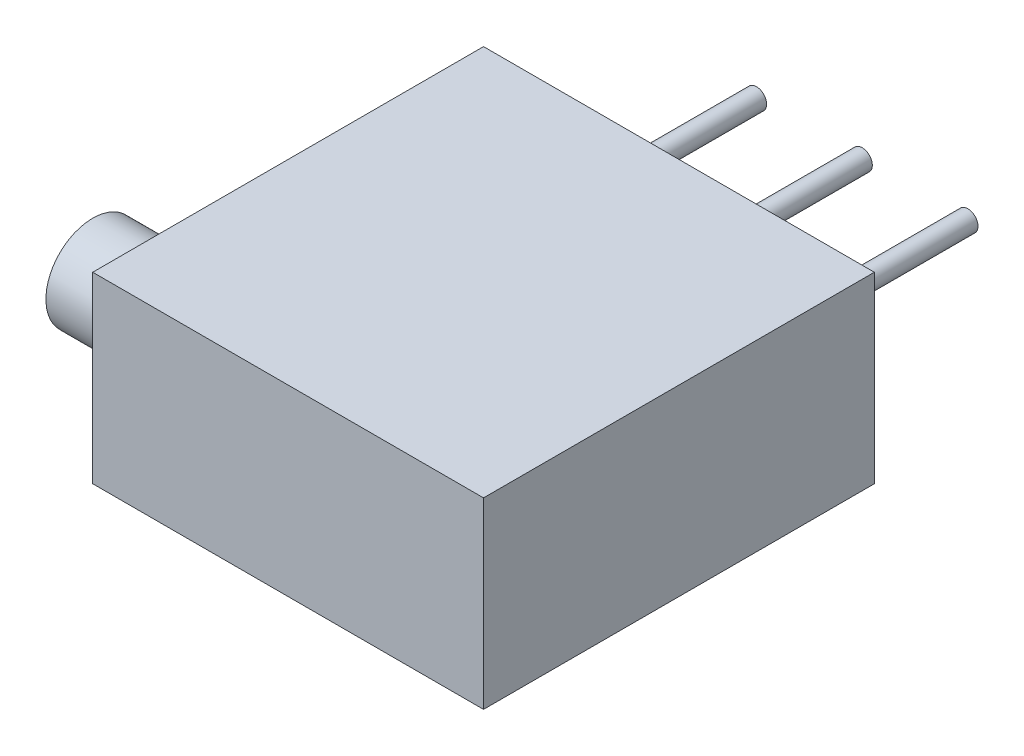
from build123d import *

# Parameters (mm, degrees)
SKETCH_1_W      = 9.6
SKETCH_1_H      = 9.6
EXTRUDE_1_DEPTH = 4.5
SKETCH_3_R      = 0.25
EXTRUDE_3_DEPTH = 4.5
SKETCH_4_R      = 1.15
EXTRUDE_4_DEPTH = 1.5


with BuildPart() as part:
    # 草图1 → 拉伸1 (new body)
    with BuildSketch(Plane(origin=(0, 0, 0), x_dir=(1, 0, 0), z_dir=(0, 1, 0))):
        Rectangle(SKETCH_1_W, SKETCH_1_H)
    extrude(amount=EXTRUDE_1_DEPTH)

    # 草图3 → 拉伸3 (add)
    with BuildSketch(Plane(origin=(0, 0, -4.8), x_dir=(-1, 0, 0), z_dir=(0, 0, -1))):
        with Locations(Location((0, 2.25, 0), (0, 0, 180))):
            Circle(SKETCH_3_R)
        with Locations(Location((2.595978382, 2.25, 0), (0, 0, 180))):
            Circle(SKETCH_3_R)
        with Locations(Location((-2.595978382, 2.25, 0), (0, 0, 180))):
            Circle(SKETCH_3_R)
    extrude(amount=EXTRUDE_3_DEPTH)

    # 草图4 → 拉伸4 (add)
    with BuildSketch(Plane(origin=(-4.8, 0, 0), x_dir=(0, 0, -1), z_dir=(1, 0, 0))):
        with Locations((-3.3, 3)):
            Circle(SKETCH_4_R)
    extrude(amount=-EXTRUDE_4_DEPTH)


solid = part.part
